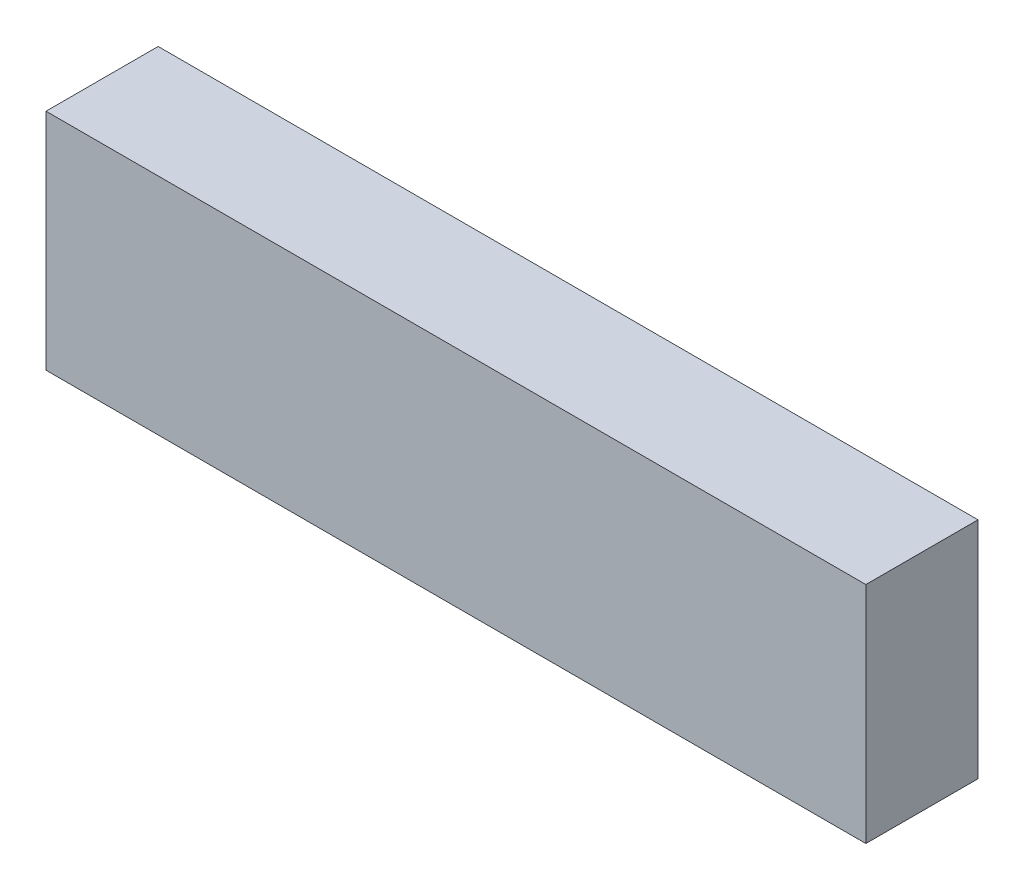
from build123d import *

# Parameters (mm, degrees)
SKETCH1_W           = 73.1
SKETCH1_H           = 20
BOSS_EXTRUDE1_DEPTH = 10


with BuildPart() as part:
    # Sketch1 → Boss-Extrude1 (new body)
    with BuildSketch(Plane.XY):
        with Locations((36.55, 10)):
            Rectangle(SKETCH1_W, SKETCH1_H)
    extrude(amount=BOSS_EXTRUDE1_DEPTH)


solid = part.part
